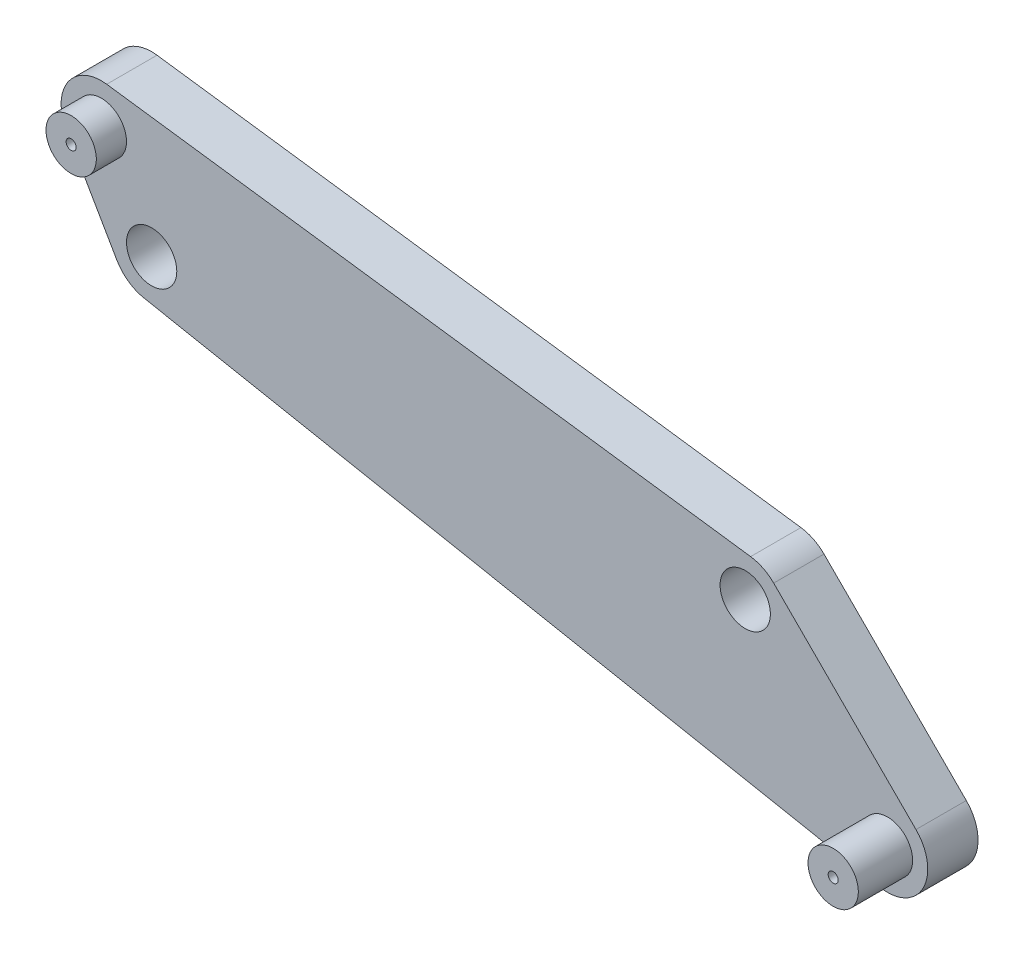
from build123d import *

# Parameters (mm, degrees)
SKETCH2_R           = 2.5
BOSS_EXTRUDE1_DEPTH = 5
SKETCH4_R           = 2.5
SKETCH4_R_2         = 0.5
BOSS_EXTRUDE3_DEPTH = 8
SKETCH5_R           = 2.5
SKETCH5_R_2         = 0.5
BOSS_EXTRUDE4_DEPTH = 2.4


with BuildPart() as part:
    # Sketch2 → Boss-Extrude1 (new body)
    with BuildSketch(Plane.XY):
        with BuildLine():
            Line((-63.463622529, 12.624128305), (0.536377471, 3.963874268))
            ThreePointArc((0.536377471, 3.963874268), (1.775609063, 3.584300832), (2.828427125, 2.828427125))
            Line((2.828427125, 2.828427125), (16.970562748, -11.313708499))
            ThreePointArc((16.970562748, -11.313708499), (17.674856638, -16.018270543), (13.38279363, -18.069399269))
            Line((13.38279363, -18.069399269), (-59.759341994, -3.927263645))
            ThreePointArc((-59.759341994, -3.927263645), (-61.321196947, -3.257613349), (-62.464101615, -2))
            Line((-62.464101615, -2), (-67.464101615, 6.660254038))
            ThreePointArc((-67.464101615, 6.660254038), (-67.321873152, 10.888517659), (-63.463622529, 12.624128305))
        make_face()
        with Locations((-59, 0)):
            Circle(SKETCH2_R, mode=Mode.SUBTRACT)
        with Locations((-64, 8.660254038)):
            Circle(SKETCH2_R, mode=Mode.SUBTRACT)
        Circle(SKETCH2_R, mode=Mode.SUBTRACT)
        with Locations((14.142135624, -14.142135624)):
            Circle(SKETCH2_R, mode=Mode.SUBTRACT)
    extrude(amount=BOSS_EXTRUDE1_DEPTH)

    # Sketch4 → Boss-Extrude3 (add)
    # profile 1 of 2: a face of its own
    with BuildSketch(Plane(origin=(0, 0, 0), x_dir=(-1, 0, 0), z_dir=(0, 0, -1))):
        with Locations((64, 8.660254038)):
            Circle(SKETCH4_R)
        with Locations((64, 8.660254038)):
            Circle(SKETCH4_R_2, mode=Mode.SUBTRACT)
    # profile 2 of 2: a face of its own
    with BuildSketch(Plane(origin=(0, 0, 0), x_dir=(-1, 0, 0), z_dir=(0, 0, -1))):
        with Locations((-14.142135624, -14.142135624)):
            Circle(SKETCH4_R)
        with Locations((-14.142135624, -14.142135624)):
            Circle(SKETCH4_R_2, mode=Mode.SUBTRACT)
    extrude(amount=-BOSS_EXTRUDE3_DEPTH)

    # Sketch5 → Boss-Extrude4 (add)
    with BuildSketch(Plane.XY.offset(8)):
        with Locations((14.142135624, -14.142135624)):
            Circle(SKETCH5_R)
        with Locations(Location((14.142135624, -14.142135624, 0), (0, 0, 180))):
            Circle(SKETCH5_R_2, mode=Mode.SUBTRACT)
    extrude(amount=BOSS_EXTRUDE4_DEPTH)


solid = part.part
